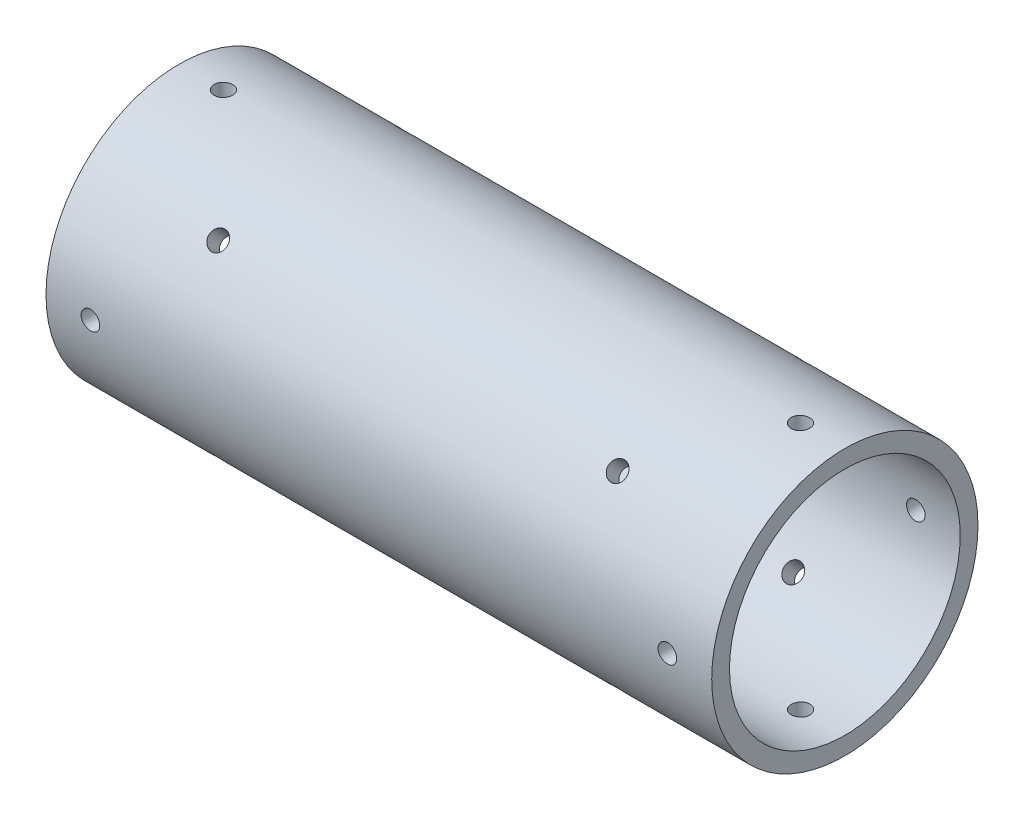
from build123d import *

# Parameters (mm, degrees)
SKETCH_1_R               = 30
SKETCH_1_R_2             = 26
EXTRUDE_1_DEPTH          = 150
SKETCH_2_R               = 2.1
CUT_EXTRUDE_1_DEPTH      = 156.884572681
SKETCH_3_R               = 2.1
CUT_EXTRUDE_2_DEPTH      = 156.884572816
PATTERN_CIRCULAR_1_COUNT = 2
PATTERN_CIRCULAR_1_ANGLE = 90


with BuildPart() as part:
    # Эскиз1 → Бобышка-Вытянуть1 (new body)
    with BuildSketch(Plane(origin=(0, 0, 0), x_dir=(0, 0, -1), z_dir=(1, 0, 0))):
        Circle(SKETCH_1_R)
        Circle(SKETCH_1_R_2, mode=Mode.SUBTRACT)
    extrude(amount=EXTRUDE_1_DEPTH)

    # Эскиз2 → Вырез-Вытянуть1 (cut, symmetric)
    with BuildSketch(Plane(origin=(0, 0, 0), x_dir=(1, 0, 0), z_dir=(0, 1, 0))):
        with Locations((10, 0)):
            Circle(SKETCH_2_R)
        with Locations((140, 0)):
            Circle(SKETCH_2_R)
    cut_extrude_1 = extrude(amount=CUT_EXTRUDE_1_DEPTH, both=True, mode=Mode.SUBTRACT)

    # Эскиз3 → Вырез-Вытянуть2 (cut, symmetric)
    with BuildSketch(Plane(origin=(0, 0, 0), x_dir=(-1, 0, 0), z_dir=(0, 0.7071067811865464, -0.7071067811865488))):
        with Locations((-120, 0)):
            Circle(SKETCH_3_R)
        with Locations((-30, 0)):
            Circle(SKETCH_3_R)
    cut_extrude_2 = extrude(amount=CUT_EXTRUDE_2_DEPTH, both=True, mode=Mode.SUBTRACT)

    # Круговой массив1: Вырез-Вытянуть1, Вырез-Вытянуть2 ×2 about axis
    pattern_circular_1_axis = Axis((150, 0, 0), (-1, 0, 0))
    add([cut_extrude_1.rotate(pattern_circular_1_axis, i * PATTERN_CIRCULAR_1_ANGLE / (PATTERN_CIRCULAR_1_COUNT - 1)) for i in range(1, PATTERN_CIRCULAR_1_COUNT)], mode=Mode.SUBTRACT)
    add([cut_extrude_2.rotate(pattern_circular_1_axis, i * PATTERN_CIRCULAR_1_ANGLE / (PATTERN_CIRCULAR_1_COUNT - 1)) for i in range(1, PATTERN_CIRCULAR_1_COUNT)], mode=Mode.SUBTRACT)


solid = part.part
